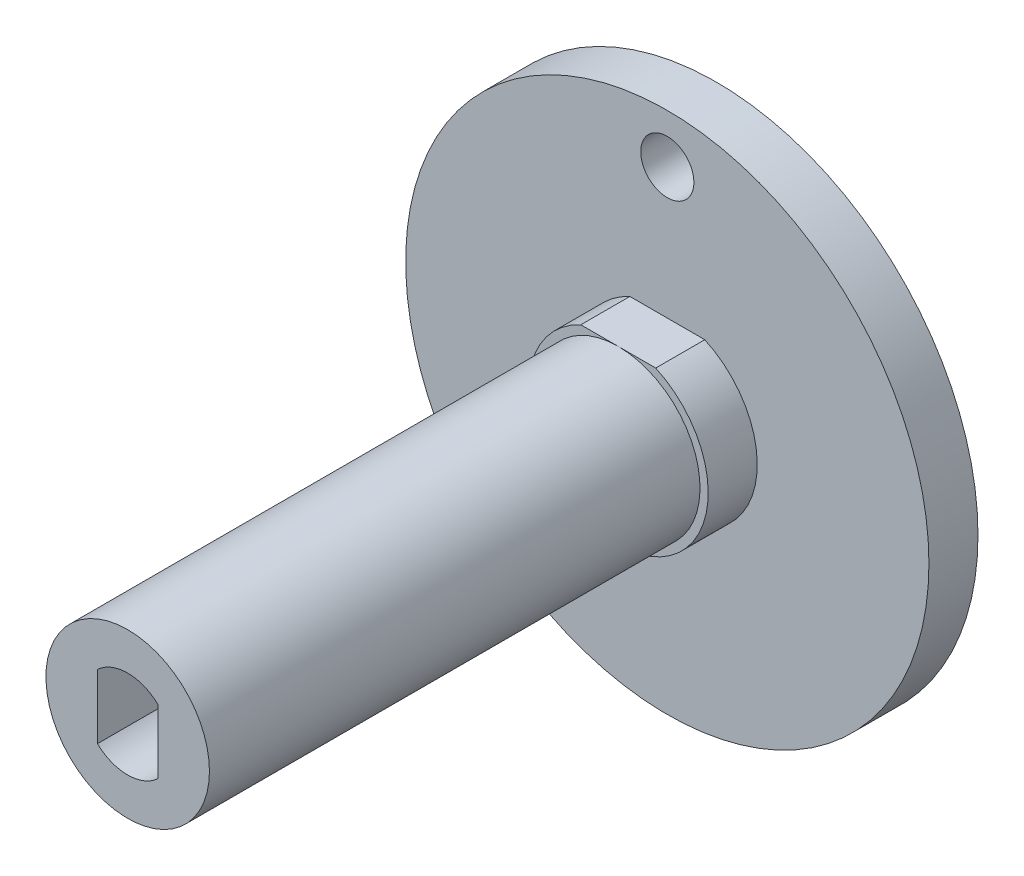
from build123d import *

# Parameters (mm, degrees)
SKETCH1_R           = 16
SKETCH1_R_2         = 1.625
BOSS_EXTRUDE1_DEPTH = 3
BOSS_EXTRUDE2_DEPTH = 3
SKETCH3_R           = 5
BOSS_EXTRUDE3_DEPTH = 30
CUT_EXTRUDE1_DEPTH  = 8


with BuildPart() as part:
    # Sketch1 → Boss-Extrude1 (new body)
    with BuildSketch(Plane.XY):
        Circle(SKETCH1_R)
        with Locations((0, 13)):
            Circle(SKETCH1_R_2, mode=Mode.SUBTRACT)
    extrude(amount=BOSS_EXTRUDE1_DEPTH)

    # Sketch2 → Boss-Extrude2 (add)
    with BuildSketch(Plane.XY.offset(3)):
        with BuildLine():
            Line((-2.291287847, 5), (2.291287847, 5))
            ThreePointArc((2.291287847, 5), (0, -5.5), (-2.291287847, 5))
        make_face()
    extrude(amount=BOSS_EXTRUDE2_DEPTH)

    # Sketch3 → Boss-Extrude3 (add)
    with BuildSketch(Plane.XY.offset(6)):
        with Locations(Location((0, 0, 0), (0, 0, 90))):
            Circle(SKETCH3_R)
    extrude(amount=BOSS_EXTRUDE3_DEPTH)

    # Sketch4 → Cut-Extrude1 (cut)
    with BuildSketch(Plane.XY.offset(36)):
        with BuildLine():
            Line((1.85, -1.966596044), (1.85, 1.966596044))
            ThreePointArc((1.85, 1.966596044), (0, 2.7), (-1.85, 1.966596044))
            Line((-1.85, 1.966596044), (-1.85, -1.966596044))
            ThreePointArc((-1.85, -1.966596044), (0, -2.7), (1.85, -1.966596044))
        make_face()
    extrude(amount=-CUT_EXTRUDE1_DEPTH, mode=Mode.SUBTRACT)


solid = part.part
